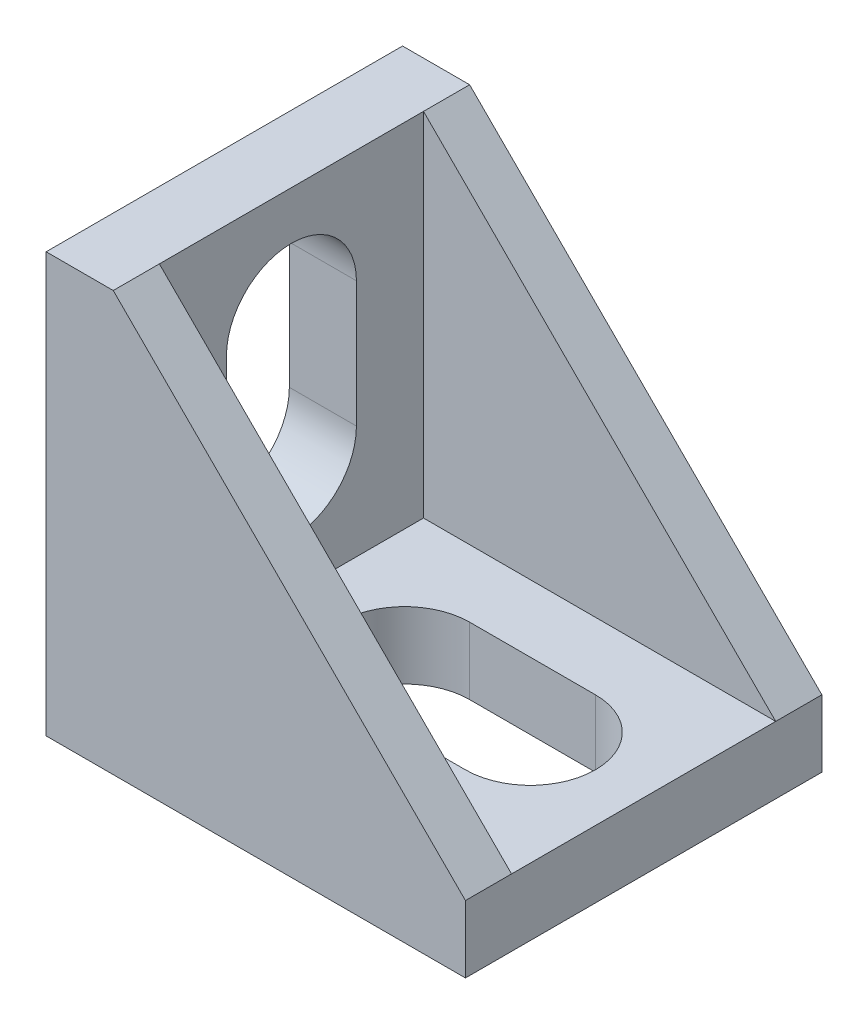
from build123d import *

# Parameters (mm, degrees)
EXTRUDE_1_DEPTH     = 17
SKETCH_2_W          = 19.894239427
SKETCH_2_H          = 12.6
CUT_EXTRUDE_1_DEPTH = 16.8
CUT_EXTRUDE_2_DEPTH = 16.8
CUT_EXTRUDE_3_DEPTH = 16.8


with BuildPart() as part:
    # 草图1 → 凸台-拉伸1 (new body)
    with BuildSketch(Plane.XY):
        Polygon((0, 0), (20, 0), (20, 3.2), (3.2, 20), (0, 20), align=None)
    extrude(amount=EXTRUDE_1_DEPTH)

    # 草图2 → 切除-拉伸1 (cut)
    with BuildSketch(Plane(origin=(0, 20, 0), x_dir=(1, 0, 0), z_dir=(0, 1, 0))):
        with Locations((13.147119714, -8.5)):
            Rectangle(SKETCH_2_W, SKETCH_2_H)
    extrude(amount=-CUT_EXTRUDE_1_DEPTH, mode=Mode.SUBTRACT)

    # 草图3 → 切除-拉伸2 (cut)
    with BuildSketch(Plane(origin=(0, 3.2, 0), x_dir=(1, 0, 0), z_dir=(0, 1, 0))):
        with BuildLine():
            Line((8.6, -5.4), (14.6, -5.4))
            ThreePointArc((14.6, -5.4), (17.7, -8.5), (14.6, -11.6))
            Line((14.6, -11.6), (8.6, -11.6))
            ThreePointArc((8.6, -11.6), (5.5, -8.5), (8.6, -5.4))
        make_face()
    extrude(amount=-CUT_EXTRUDE_2_DEPTH, mode=Mode.SUBTRACT)

    # 草图4 → 切除-拉伸3 (cut)
    with BuildSketch(Plane(origin=(3.2, 0, 0), x_dir=(0, 0, -1), z_dir=(1, 0, 0))):
        with BuildLine():
            Line((-5.4, 14.6), (-5.4, 8.6))
            ThreePointArc((-5.4, 8.6), (-8.5, 5.5), (-11.6, 8.6))
            Line((-11.6, 8.6), (-11.6, 14.6))
            ThreePointArc((-11.6, 14.6), (-8.5, 17.7), (-5.4, 14.6))
        make_face()
    extrude(amount=-CUT_EXTRUDE_3_DEPTH, mode=Mode.SUBTRACT)


solid = part.part
